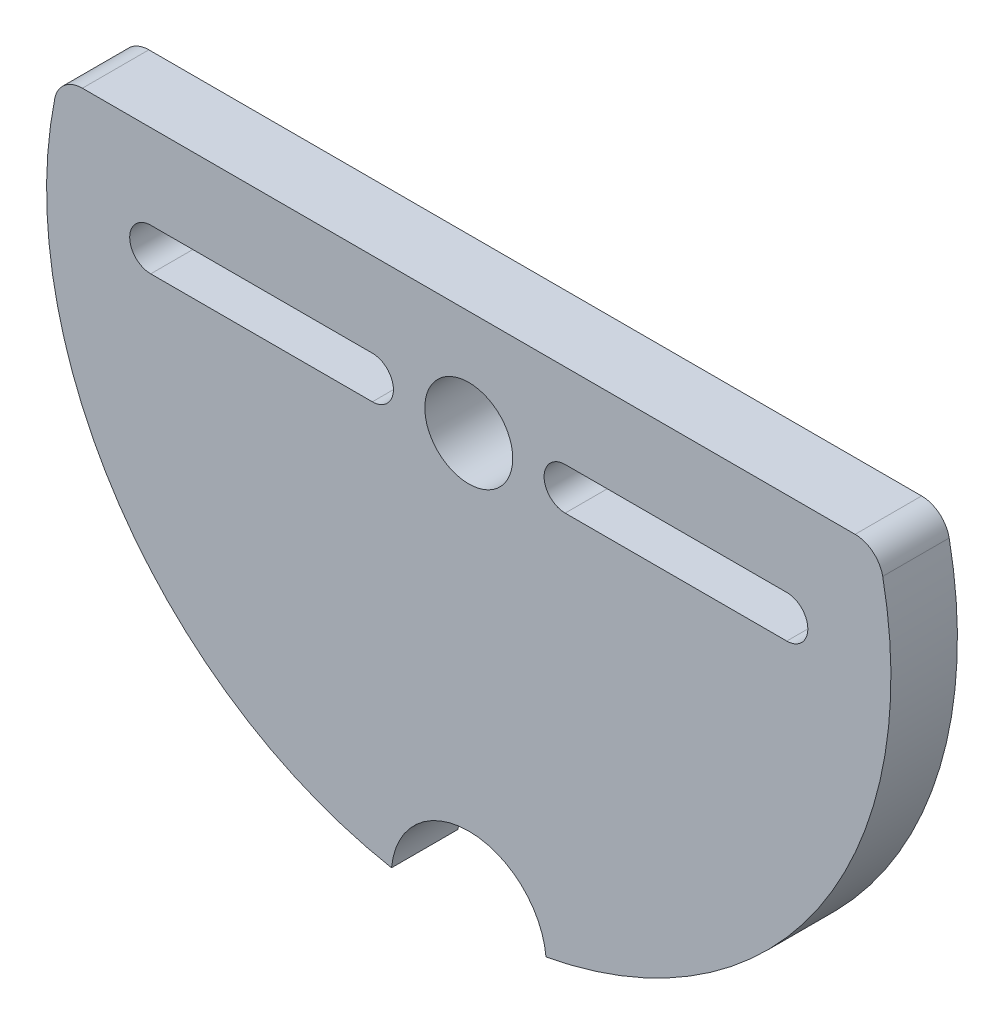
from build123d import *

# Parameters (mm, degrees)
BOSS_EXTRUDE1_DEPTH = 3
SKETCH4_R           = 1.984375
CUT_EXTRUDE2_DEPTH  = 27.882306013


with BuildPart() as part:
    # Sketch1 → Boss-Extrude1 (new body)
    with BuildSketch(Plane.XY):
        with BuildLine():
            Line((17.43361247, 4.7625), (-17.43361247, 4.7625))
            ThreePointArc((-17.43361247, 4.7625), (-18.238621898, 4.474772784), (-18.678870503, 3.741964286))
            ThreePointArc((-18.678870503, 3.741964286), (-15.78105519, -10.670557487), (-3.485200626, -18.72847769))
            ThreePointArc((-3.485200626, -18.72847769), (0, -15.55), (3.485200626, -18.72847769))
            ThreePointArc((3.485200626, -18.72847769), (15.78105519, -10.670557487), (18.678870503, 3.741964286))
            ThreePointArc((18.678870503, 3.741964286), (18.238621898, 4.474772784), (17.43361247, 4.7625))
        make_face()
    extrude(amount=BOSS_EXTRUDE1_DEPTH)

    # Sketch4 → Cut-Extrude2 (cut, through all)
    with BuildSketch(Plane.XY.offset(3)):
        Circle(SKETCH4_R)
        with BuildLine():
            Line((-14.350000002, 0.95), (-4.35, 0.95))
            ThreePointArc((-4.35, 0.95), (-3.4, 0), (-4.35, -0.95))
            Line((-4.35, -0.95), (-14.350000002, -0.95))
            ThreePointArc((-14.350000002, -0.95), (-15.300000002, 0), (-14.350000002, 0.95))
        make_face()
        with BuildLine():
            Line((4.35, 0.95), (14.350000002, 0.95))
            ThreePointArc((14.350000002, 0.95), (15.300000002, 0), (14.350000002, -0.95))
            Line((14.350000002, -0.95), (4.35, -0.95))
            ThreePointArc((4.35, -0.95), (3.4, 0), (4.35, 0.95))
        make_face()
    extrude(amount=-CUT_EXTRUDE2_DEPTH, mode=Mode.SUBTRACT)


solid = part.part
